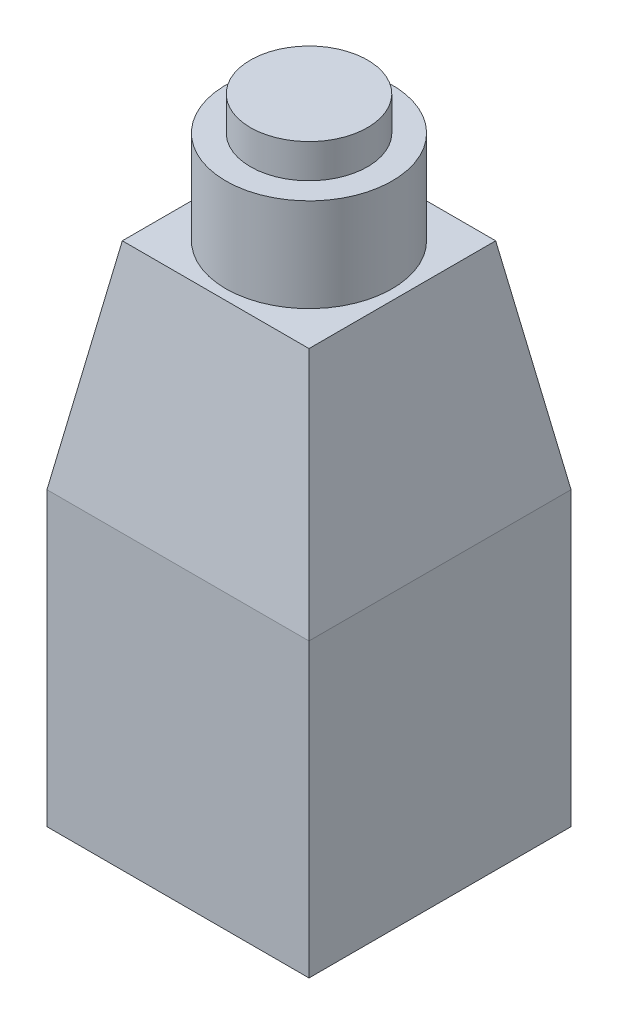
from build123d import *

# Parameters (mm, degrees)
SKETCH_1_W      = 15.44
SKETCH_1_H      = 15.44
EXTRUDE_1_DEPTH = 17.2
SKETCH_3_R      = 4.9
EXTRUDE_2_DEPTH = 5.5
SKETCH_4_R      = 3.45
EXTRUDE_3_DEPTH = 2


with BuildPart() as part:
    # Эскиз1 → Бобышка-Вытянуть1 (new body)
    with BuildSketch(Plane(origin=(0, 0, 0), x_dir=(1, 0, 0), z_dir=(0, 1, 0))):
        Rectangle(SKETCH_1_W, SKETCH_1_H)
    extrude(amount=EXTRUDE_1_DEPTH)

    # Эскиз2 → section 0 of loft_1
    with BuildSketch(Plane(origin=(0, 29.9, 0), x_dir=(1, 0, 0), z_dir=(0, 1, 0)), mode=Mode.PRIVATE) as loft_1_s0:
        with BuildLine():
            Line((-5.5, 5.5), (5.5, 5.5))
            Line((5.5, 5.5), (5.5, -5.5))
            Line((5.5, -5.5), (-5.5, -5.5))
            Line((-5.5, -5.5), (-5.5, 5.5))
        make_face()
    # loft up to a face of the part (loft_1)
    loft([loft_1_s0.sketch, part.faces().sort_by_distance((0, 17.2, 0))[0]])

    # Эскиз3 → Бобышка-Вытянуть2 (add)
    with BuildSketch(Plane(origin=(0, 29.9, 0), x_dir=(1, 0, 0), z_dir=(0, 1, 0))):
        with Locations(Location((0, 0, 0), (0, 0, 270))):
            Circle(SKETCH_3_R)
    extrude(amount=EXTRUDE_2_DEPTH)

    # Эскиз4 → Бобышка-Вытянуть3 (add)
    with BuildSketch(Plane(origin=(0, 35.4, 0), x_dir=(1, 0, 0), z_dir=(0, 1, 0))):
        with Locations(Location((0, 0, 0), (0, 0, 270))):
            Circle(SKETCH_4_R)
    extrude(amount=EXTRUDE_3_DEPTH)


solid = part.part
